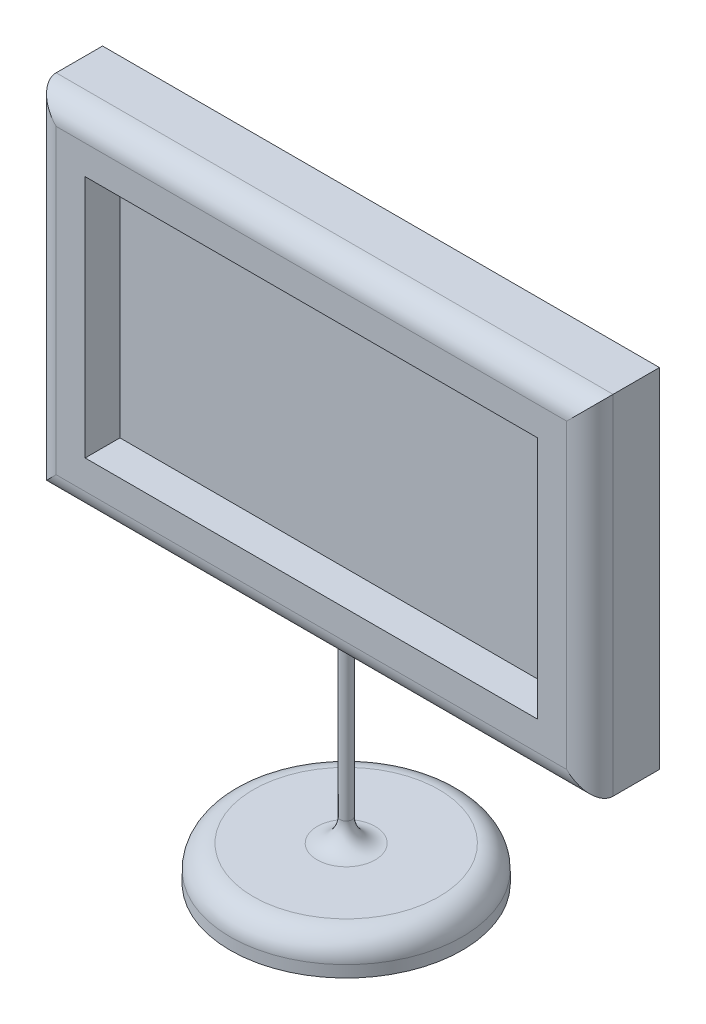
from build123d import *

# Parameters (mm, degrees)
SKETCH1_R           = 50
BOSS_EXTRUDE1_DEPTH = 15
FILLET1_R           = 10
SKETCH5_R           = 2.5
BOSS_EXTRUDE2_DEPTH = 80
FILLET2_R           = 10
SKETCH6_W           = 240
SKETCH6_H           = 150
BOSS_EXTRUDE3_DEPTH = 15
SKETCH7_W           = 195
SKETCH7_H           = 105
CUT_EXTRUDE1_DEPTH  = 15
FILLET3_R           = 10


with BuildPart() as part:
    # Sketch1 → Boss-Extrude1 (new body)
    with BuildSketch(Plane(origin=(0, 0, 0), x_dir=(1, 0, 0), z_dir=(0, 1, 0))):
        with Locations(Location((0, 0, 0), (0, 0, 270))):
            Circle(SKETCH1_R)
    extrude(amount=BOSS_EXTRUDE1_DEPTH)

    # Fillet1
    fillet1_edges = [part.edges().sort_by_distance(p)[0] for p in [
        (0, 15, -50),
    ]]
    fillet(fillet1_edges, radius=FILLET1_R)

    # Sketch3 → Cut-Revolve1 (revolve, cut)
    with BuildSketch(Plane.XY, mode=Mode.PRIVATE) as cut_revolve1_sk:
        with BuildLine():
            Line((0, 0), (40, 0))
            Line((40, 0), (40, 5))
            ThreePointArc((40, 5), (38.535533906, 8.535533906), (35, 10))
            Line((35, 10), (0, 10))
            Line((0, 10), (0, 0))
        make_face()
    revolve(cut_revolve1_sk.sketch.rotate(Axis((0, 0, 0), (0, 1, 0)), 90), axis=Axis((0, 0, 0), (0, 1, 0)), mode=Mode.SUBTRACT)

    # Sketch5 → Boss-Extrude2 (add)
    with BuildSketch(Plane(origin=(0, 15, 0), x_dir=(1, 0, 0), z_dir=(0, 1, 0))):
        with Locations(Location((0, 0, 0), (0, 0, 270))):
            Circle(SKETCH5_R)
    extrude(amount=BOSS_EXTRUDE2_DEPTH)

    # Fillet2
    fillet2_edges = [part.edges().sort_by_distance(p)[0] for p in [
        (0, 15, -2.5),
    ]]
    fillet(fillet2_edges, radius=FILLET2_R)

    # Sketch6 → Boss-Extrude3 (add, symmetric)
    with BuildSketch(Plane.XY):
        with Locations((0, 170)):
            Rectangle(SKETCH6_W, SKETCH6_H)
    extrude(amount=BOSS_EXTRUDE3_DEPTH, both=True)

    # Sketch7 → Cut-Extrude1 (cut)
    with BuildSketch(Plane.XY.offset(15)):
        with Locations((0, 170)):
            Rectangle(SKETCH7_W, SKETCH7_H)
    extrude(amount=-CUT_EXTRUDE1_DEPTH, mode=Mode.SUBTRACT)

    # Fillet3
    fillet3_edges = [part.edges().sort_by_distance(p)[0] for p in [
        (-120, 170, 15),
        (0, 95, 15),
        (120, 170, 15),
        (0, 245, 15),
    ]]
    fillet(fillet3_edges, radius=FILLET3_R)


solid = part.part
